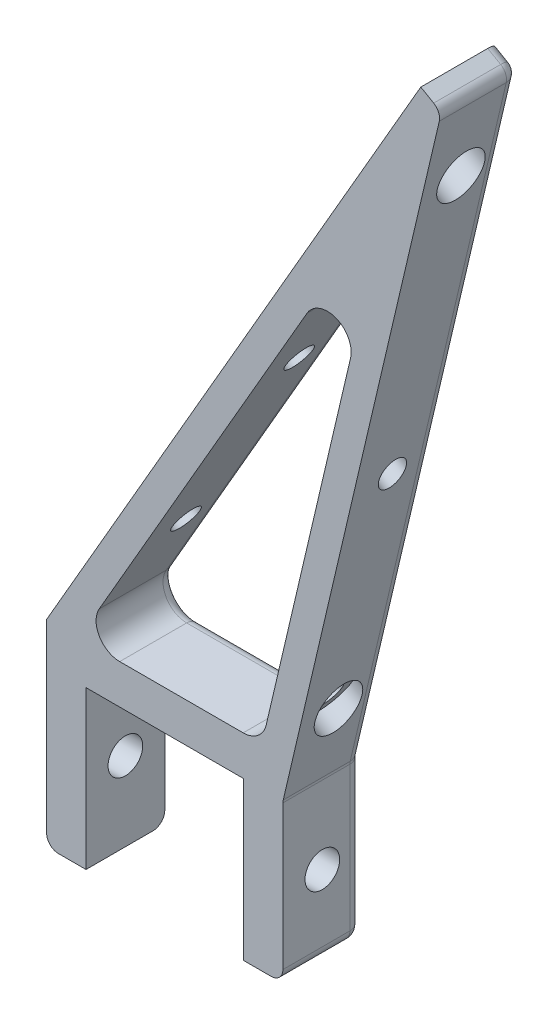
from build123d import *

# Parameters (mm, degrees)
BOSS_EXTRUDE1_DEPTH = 10
CUT_EXTRUDE1_DEPTH  = 95.596978287
FILLET1_R           = 3
FILLET2_R           = 1.5
SKETCH3_R           = 2.2
CUT_EXTRUDE2_DEPTH  = 102.020680113
SKETCH4_R           = 1.75
CUT_EXTRUDE3_DEPTH  = 94.58236857
CUT_EXTRUDE4_START  = 3
SKETCH5_R           = 3
CUT_EXTRUDE4_DEPTH  = 91.712514751
CUT_EXTRUDE5_START  = -24.38
SKETCH6_R           = 3
CUT_EXTRUDE5_DEPTH  = 70.20236857


with BuildPart() as part:
    # Sketch1 → Boss-Extrude1 (new body)
    with BuildSketch(Plane.XY):
        Polygon((-10, -20), (-10, 0), (10, 0), (10, -20), (15, -20), (15, 0), (35.101483834, 85.770445967), (32.5, 87.27241336), (-15, 5), (-15, -20), align=None)
    extrude(amount=BOSS_EXTRUDE1_DEPTH)

    # Sketch2 → Cut-Extrude1 (cut, through all)
    with BuildSketch(Plane.XY.offset(10)):
        Polygon((-10.917498512, 5), (28.214788811, 72.779109859), (12.329822075, 5), align=None)
    extrude(amount=-CUT_EXTRUDE1_DEPTH, mode=Mode.SUBTRACT)

    # Fillet1
    fillet1_edges = [part.edges().sort_by_distance(p)[0] for p in [
        (28.214788811, 72.779109859, 5),
        (12.329822075, 5, 5),
        (-10.917498512, 5, 5),
    ]]
    fillet(fillet1_edges, radius=FILLET1_R)

    # Fillet2
    fillet2_edges = [part.edges().sort_by_distance(p)[0] for p in [
        (33.800741917, 86.521429663, 0),
        (25.050741917, 42.885222984, 0),
        (15, -10, 0),
        (12.5, -20, 0),
        (-12.5, -20, 0),
        (-15, -20, 5),
        (35.101483834, 85.770445967, 5),
        (15, 0, 5),
        (15, -20, 5),
        (4.871758353, 32.347795103, 0),
        (18.227176379, 30.163252268, 0),
        (2.115139497, 5, 0),
        (21.765145456, 56.485016027, 0),
        (11.815273588, 5.649082253, 0),
        (-8.3194223, 6.5, 0),
        (-15, -7.5, 0),
    ]]
    fillet(fillet2_edges, radius=FILLET2_R)

    # Sketch3 → Cut-Extrude2 (cut, through all)
    with BuildSketch(Plane.ZY.offset(15)):
        with Locations(Location((5, -10, 0), (0, 0, 270))):
            Circle(SKETCH3_R)
    extrude(amount=-CUT_EXTRUDE2_DEPTH, mode=Mode.SUBTRACT)

    # Sketch4 → Cut-Extrude3 (cut, through all)
    with BuildSketch(Plane(origin=(-13.415063509, 7.745190528, 0), x_dir=(0, 0, 1), z_dir=(-0.866025403784438, 0.5000000000000009, 0))):
        with Locations(Location((5, 81.330127019, 0), (0, 0, 270))):
            Circle(SKETCH4_R)
        with Locations(Location((5, 44.830127019, 0), (0, 0, 270))):
            Circle(SKETCH4_R)
        with Locations(Location((5, 16.098937019, 0), (0, 0, 270))):
            Circle(SKETCH4_R)
    extrude(amount=-CUT_EXTRUDE3_DEPTH, mode=Mode.SUBTRACT)

    # Sketch5 → Cut-Extrude4 (cut, through all)
    with BuildSketch(Plane(origin=(-13.480526942, 7.631804537, 0), x_dir=(0, 0, -1), z_dir=(0.8660254037844382, -0.500000000000001, 0)).offset(CUT_EXTRUDE4_START)):
        with Locations(Location((-5, 81.461053884, 0), (0, 0, 90))):
            Circle(SKETCH5_R)
    extrude(amount=CUT_EXTRUDE4_DEPTH, mode=Mode.SUBTRACT)

    # Sketch6 → Cut-Extrude5 (cut, through all)
    with BuildSketch(Plane(origin=(-13.415063509, 7.745190528, 0), x_dir=(0, 0, 1), z_dir=(-0.866025403784438, 0.5000000000000009, 0)).offset(CUT_EXTRUDE5_START)):
        with Locations(Location((5, 16.098937019, 0), (0, 0, 270))):
            Circle(SKETCH6_R)
    extrude(amount=-CUT_EXTRUDE5_DEPTH, mode=Mode.SUBTRACT)


solid = part.part
